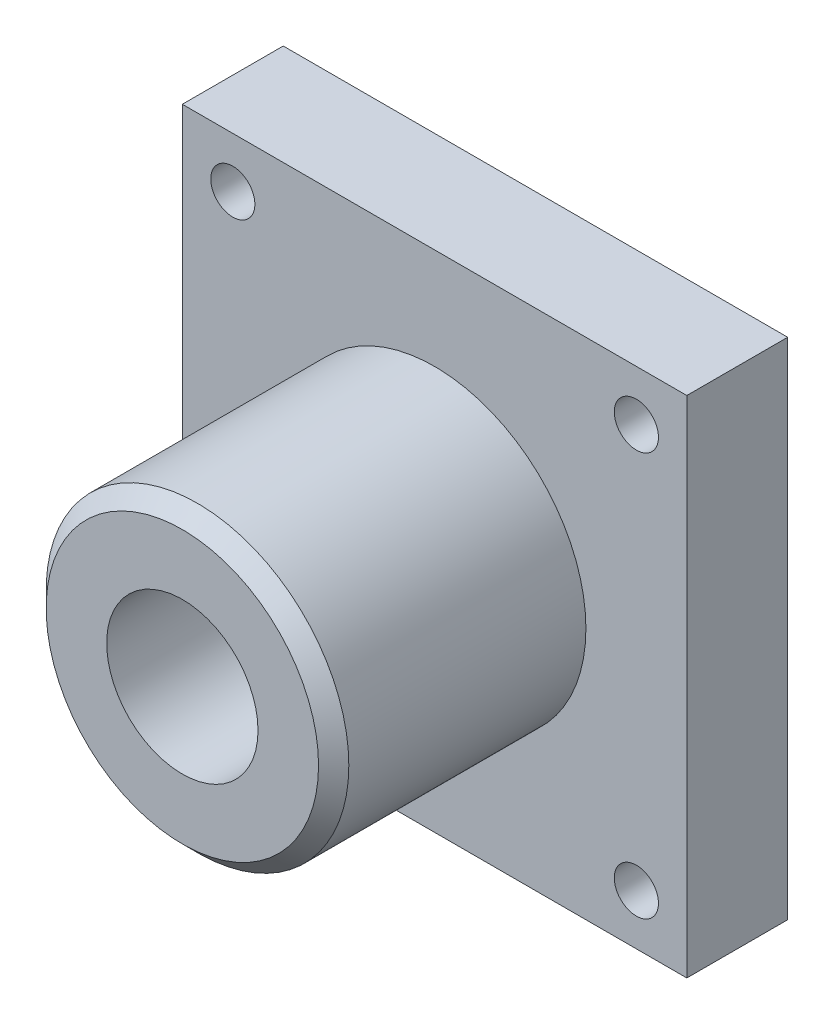
from build123d import *

# Parameters (mm, degrees)
SKETCH1_W                    = 254
SKETCH1_H                    = 254
BOSS_EXTRUDE1_DEPTH          = 50.8
SKETCH2_R                    = 76.2
BOSS_EXTRUDE2_DEPTH          = 127
CHAMFER1_SIZE                = 7.62
SKETCH3_R                    = 38.1
CUT_EXTRUDE1_DEPTH           = 253.726809025
F_7_8_0_875_DIAMETER_HOLE1_D = 22.225


with BuildPart() as part:
    # Sketch1 → Boss-Extrude1 (new body)
    with BuildSketch(Plane.XY):
        Rectangle(SKETCH1_W, SKETCH1_H)
    extrude(amount=BOSS_EXTRUDE1_DEPTH)

    # Sketch2 → Boss-Extrude2 (add)
    with BuildSketch(Plane.XY.offset(50.8)):
        Circle(SKETCH2_R)
    extrude(amount=BOSS_EXTRUDE2_DEPTH)

    # Chamfer1
    chamfer1_edges = [part.edges().sort_by_distance(p)[0] for p in [
        (-76.2, 0, 177.8),
    ]]
    chamfer(chamfer1_edges, length=CHAMFER1_SIZE)

    # Sketch3 → Cut-Extrude1 (cut, through all)
    with BuildSketch(Plane.XY.offset(177.8)):
        Circle(SKETCH3_R)
    extrude(amount=-CUT_EXTRUDE1_DEPTH, mode=Mode.SUBTRACT)

    # 7/8 (0.875) Diameter Hole1 (through all)
    with Locations(Plane.XY.offset(50.8)):
        with Locations((-101.6, 101.6), (101.6, 101.6), (101.6, -101.6), (-101.6, -101.6)):
            Hole(F_7_8_0_875_DIAMETER_HOLE1_D / 2)


solid = part.part
